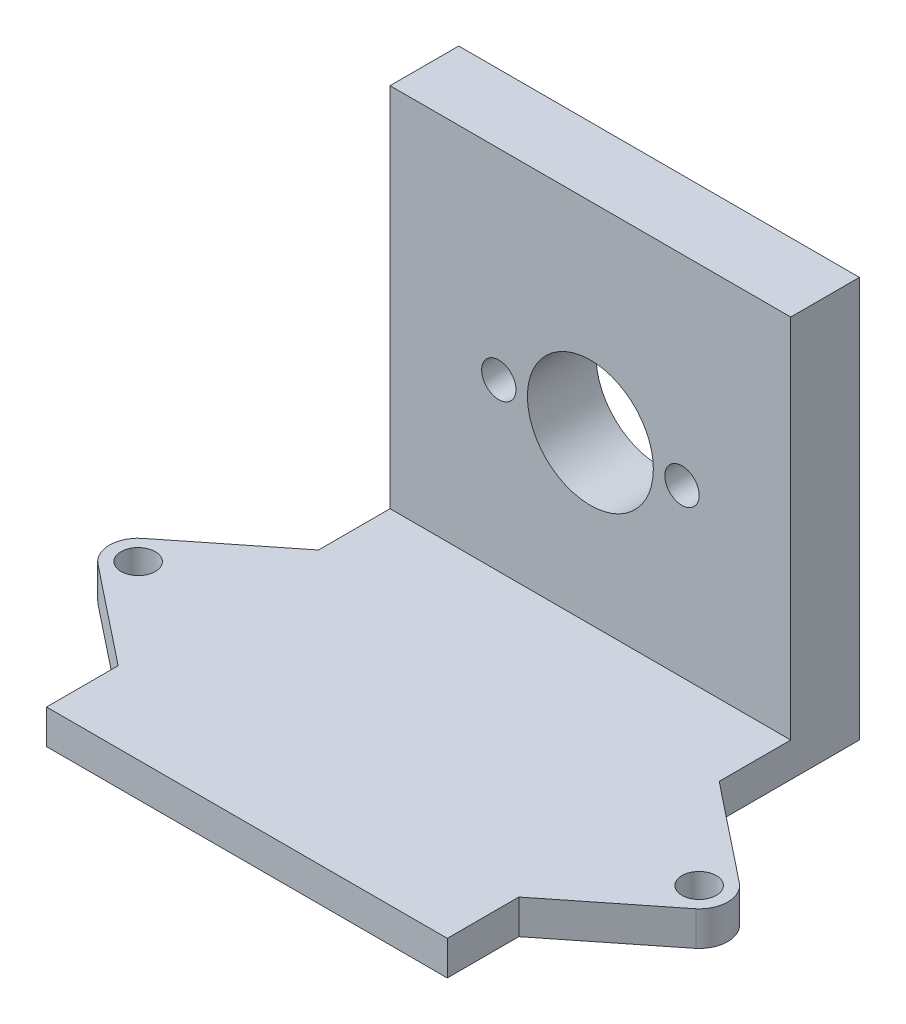
from build123d import *

# Parameters (mm, degrees)
SKETCH1_W           = 35
SKETCH1_H           = 35
SKETCH1_R           = 5.5
SKETCH1_R_2         = 1.5
BOSS_EXTRUDE1_DEPTH = 6
SKETCH2_W           = 35
SKETCH2_H           = 3
BOSS_EXTRUDE2_DEPTH = 30
SKETCH3_R           = 1.5
BOSS_EXTRUDE3_DEPTH = 3


with BuildPart() as part:
    # Sketch1 → Boss-Extrude1 (new body)
    with BuildSketch(Plane.XY):
        Rectangle(SKETCH1_W, SKETCH1_H)
        Circle(SKETCH1_R, mode=Mode.SUBTRACT)
        with Locations((8, 0)):
            Circle(SKETCH1_R_2, mode=Mode.SUBTRACT)
        with Locations((-8, 0)):
            Circle(SKETCH1_R_2, mode=Mode.SUBTRACT)
    extrude(amount=BOSS_EXTRUDE1_DEPTH)

    # Sketch2 → Boss-Extrude2 (add)
    with BuildSketch(Plane.XY.offset(6)):
        with Locations((0, -16)):
            Rectangle(SKETCH2_W, SKETCH2_H)
    extrude(amount=BOSS_EXTRUDE2_DEPTH)

    # Sketch3 → Boss-Extrude3 (add)
    # profile 1 of 2: a face of its own
    with BuildSketch(Plane(origin=(0, -14.5, 0), x_dir=(1, 0, 0), z_dir=(0, 1, 0))):
        with BuildLine():
            Line((17.5, -29.75), (17.5, -12.25))
            Line((17.5, -12.25), (26.114080353, -19.090878575))
            ThreePointArc((26.114080353, -19.090878575), (27, -21), (26.114080353, -22.909121425))
            Line((26.114080353, -22.909121425), (17.5, -29.75))
        make_face()
        with Locations(Location((24.5, -21, 0), (0, 0, 270))):
            Circle(SKETCH3_R, mode=Mode.SUBTRACT)
    # profile 2 of 2: a face of its own
    with BuildSketch(Plane(origin=(0, -14.5, 0), x_dir=(1, 0, 0), z_dir=(0, 1, 0))):
        with BuildLine():
            Line((-17.5, -29.75), (-17.5, -12.25))
            Line((-17.5, -12.25), (-26.114080353, -19.090878575))
            ThreePointArc((-26.114080353, -19.090878575), (-27, -21), (-26.114080353, -22.909121425))
            Line((-26.114080353, -22.909121425), (-17.5, -29.75))
        make_face()
        with Locations(Location((-24.5, -21, 0), (0, 0, 270))):
            Circle(SKETCH3_R, mode=Mode.SUBTRACT)
    extrude(amount=-BOSS_EXTRUDE3_DEPTH)


solid = part.part
